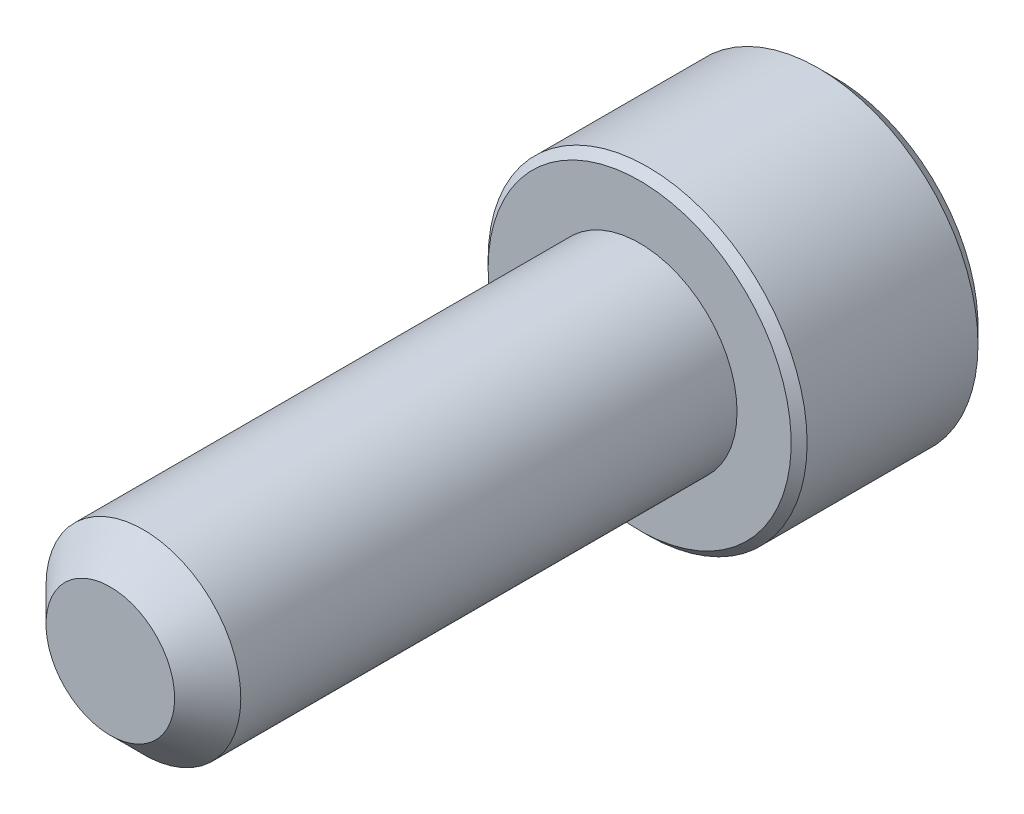
from build123d import *

# Parameters (mm, degrees)
SKETCH1_R          = 1.7526
EXTRUDE1_DEPTH     = 9.525
CHAMFER3_SIZE      = 0.5953125
SKETCH6_R          = 2.8702
EXTRUDE2_DEPTH     = 3.5052
CUT_EXTRUDE1_DEPTH = 2.08359375
CHAMFER1_SIZE      = 0.28702
CHAMFER2_SIZE      = 0.14351


with BuildPart() as part:
    # Sketch1 → Extrude1 (new body)
    with BuildSketch(Plane.XY):
        Circle(SKETCH1_R)
    extrude(amount=-EXTRUDE1_DEPTH)

    # Chamfer3
    chamfer3_edges = [part.edges().sort_by_distance(p)[0] for p in [
        (-1.7526, 0, 0),
    ]]
    chamfer(chamfer3_edges, length=CHAMFER3_SIZE)

    # Sketch6 → Extrude2 (add)
    with BuildSketch(Plane(origin=(0, 0, -9.525), x_dir=(-1, 0, 0), z_dir=(0, 0, -1))):
        Circle(SKETCH6_R)
    extrude(amount=EXTRUDE2_DEPTH)

    # Sketch7 → Cut-Extrude1 (cut)
    with BuildSketch(Plane(origin=(0, 0, -13.0302), x_dir=(-1, 0, 0), z_dir=(0, 0, -1))):
        Polygon((0, 1.603951217), (-1.3890625, 0.801975608), (-1.3890625, -0.801975608), (0, -1.603951217), (1.3890625, -0.801975608), (1.3890625, 0.801975608), align=None)
    extrude(amount=-CUT_EXTRUDE1_DEPTH, mode=Mode.SUBTRACT)

    # Cut-Extrude2 cone 1 section (through the dimple's axis) → Cut-Extrude2 (revolve, cut)
    with BuildSketch(Plane(origin=(0, 0, -13.0302), x_dir=(0, 1, 0), z_dir=(1, 0, 0))):
        Polygon((0, 0), (1.603951217, 0), (0, 1.603951217), align=None)
    revolve(axis=Axis((0, 0, -13.0302), (0, 0, 1)), mode=Mode.SUBTRACT)

    # Chamfer1
    chamfer1_edges = [part.edges().sort_by_distance(p)[0] for p in [
        (2.8702, 0, -13.0302),
    ]]
    chamfer(chamfer1_edges, length=CHAMFER1_SIZE)

    # Chamfer2
    chamfer2_edges = [part.edges().sort_by_distance(p)[0] for p in [
        (2.8702, 0, -9.525),
    ]]
    chamfer(chamfer2_edges, length=CHAMFER2_SIZE)


solid = part.part
